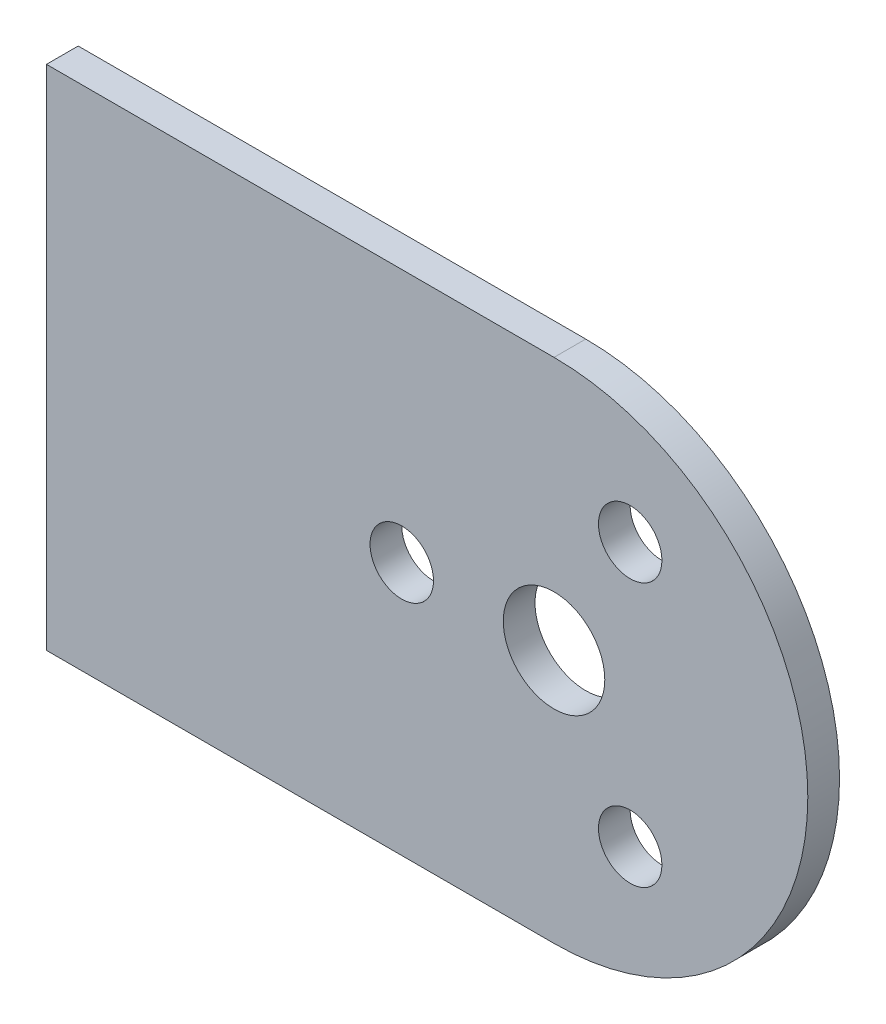
from build123d import *

# Parameters (mm, degrees)
SKETCH1_R           = 5.08
SKETCH1_R_2         = 3.175
BOSS_EXTRUDE1_DEPTH = 3.175


with BuildPart() as part:
    # Sketch1 → Boss-Extrude1 (new body)
    with BuildSketch(Plane.XY):
        with BuildLine():
            Line((22.225, 50.613247917), (-28.575, 50.613247917))
            Line((-28.575, 50.613247917), (-28.575, 101.413247917))
            Line((-28.575, 101.413247917), (22.225, 101.413247917))
            ThreePointArc((22.225, 101.413247917), (47.625, 76.013247917), (22.225, 50.613247917))
        make_face()
        with Locations((22.225, 76.013247917)):
            Circle(SKETCH1_R, mode=Mode.SUBTRACT)
        with Locations((6.985, 76.013247917)):
            Circle(SKETCH1_R_2, mode=Mode.SUBTRACT)
        with Locations((29.845, 89.211475071)):
            Circle(SKETCH1_R_2, mode=Mode.SUBTRACT)
        with Locations((29.845, 62.815020764)):
            Circle(SKETCH1_R_2, mode=Mode.SUBTRACT)
    extrude(amount=BOSS_EXTRUDE1_DEPTH)


solid = part.part
